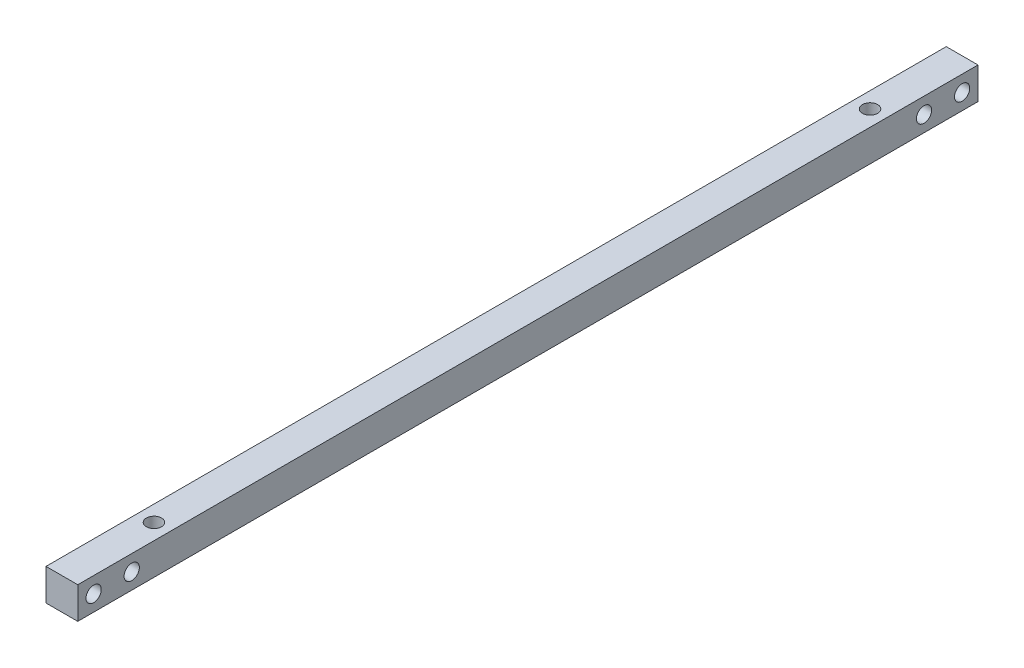
from build123d import *

# Parameters (mm, degrees)
CROQUIS1_W              = 177.2
CROQUIS1_H              = 6.25
SALIENTE_EXTRUIR1_DEPTH = 3.125
CROQUIS4_R              = 1.5
CORTAR_EXTRUIR1_DEPTH   = 15
CROQUIS5_R              = 1.5
CORTAR_EXTRUIR3_DEPTH   = 368


with BuildPart() as part:
    # Croquis1 → Saliente-Extruir1 (new, symmetric)
    with BuildSketch(Plane(origin=(0, 0, 0), x_dir=(0, 0, -1), z_dir=(1, 0, 0))):
        Rectangle(CROQUIS1_W, CROQUIS1_H)
    extrude(amount=SALIENTE_EXTRUIR1_DEPTH, both=True)

    # Croquis4 → Cortar-Extruir1 (cut, symmetric)
    with BuildSketch(Plane(origin=(3.125, 0, 0), x_dir=(0, 0, -1), z_dir=(1, 0, 0))):
        with Locations(Location((85.475, 0, 0), (0, 0, 180))):
            Circle(CROQUIS4_R)
        with Locations(Location((77.975, 0, 0), (0, 0, 180))):
            Circle(CROQUIS4_R)
        with Locations(Location((-85.475, 0, 0), (0, 0, 180))):
            Circle(CROQUIS4_R)
        with Locations(Location((-77.975, 0, 0), (0, 0, 180))):
            Circle(CROQUIS4_R)
    extrude(amount=CORTAR_EXTRUIR1_DEPTH, both=True, mode=Mode.SUBTRACT)

    # Croquis5 → Cortar-Extruir3 (cut)
    with BuildSketch(Plane.XZ.offset(3.125)):
        with Locations(Location((0, -70.475, 0), (0, 0, 270))):
            Circle(CROQUIS5_R)
        with Locations(Location((0, 70.475, 0), (0, 0, 270))):
            Circle(CROQUIS5_R)
    extrude(amount=-CORTAR_EXTRUIR3_DEPTH, mode=Mode.SUBTRACT)


solid = part.part
